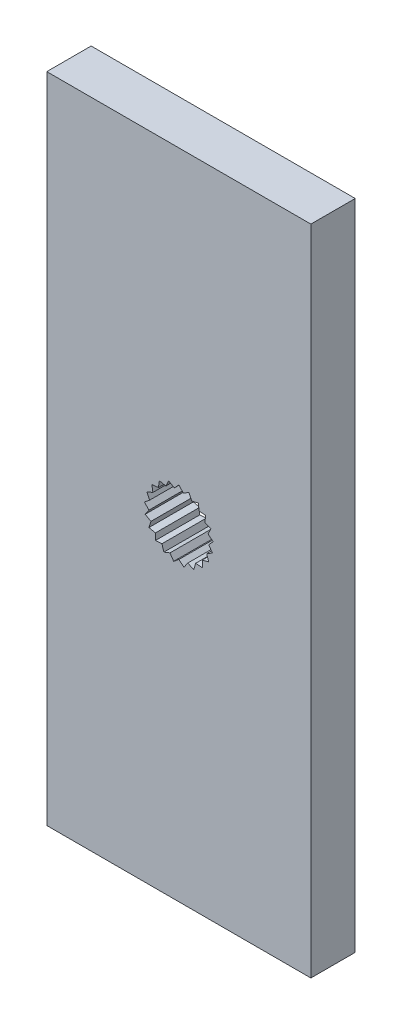
from build123d import *

# Parameters (mm, degrees)
MODEL_W             = 17.8592
MODEL_H             = 44.1523
BOSS_EXTRUDE1_DEPTH = 3


with BuildPart() as part:
    # Model → Boss-Extrude1 (new body)
    with BuildSketch(Plane.XY):
        with Locations((-478.3454, 208.16575)):
            Rectangle(MODEL_W, MODEL_H)
        Polygon((-478.3454, 210.503), (-478.0431, 210.1768), (-477.6584, 210.3991), (-477.4655, 209.9981), (-477.0325, 210.0969), (-476.9659, 209.6567), (-476.5232, 209.623), (-476.589, 209.1827), (-476.1758, 209.0197), (-476.3682, 208.6184), (-476.0213, 208.3405), (-476.323, 208.0138), (-476.0732, 207.6458), (-476.4575, 207.4228), (-476.327, 206.9973), (-476.7598, 206.8979), (-476.7601, 206.4526), (-477.2029, 206.4855), (-477.3341, 206.0602), (-477.7476, 206.2225), (-477.998, 205.8548), (-478.3454, 206.1321), (-478.6928, 205.8548), (-478.9432, 206.2225), (-479.3567, 206.0602), (-479.4879, 206.4855), (-479.9307, 206.4526), (-479.931, 206.8979), (-480.3638, 206.9973), (-480.2333, 207.4228), (-480.6176, 207.6458), (-480.3678, 208.0138), (-480.6695, 208.3405), (-480.3226, 208.6184), (-480.515, 209.0197), (-480.1018, 209.1827), (-480.1676, 209.623), (-479.7249, 209.6567), (-479.6583, 210.0969), (-479.2253, 209.9981), (-479.0324, 210.3991), (-478.6477, 210.1768), align=None, mode=Mode.SUBTRACT)
    extrude(amount=BOSS_EXTRUDE1_DEPTH)


solid = part.part
